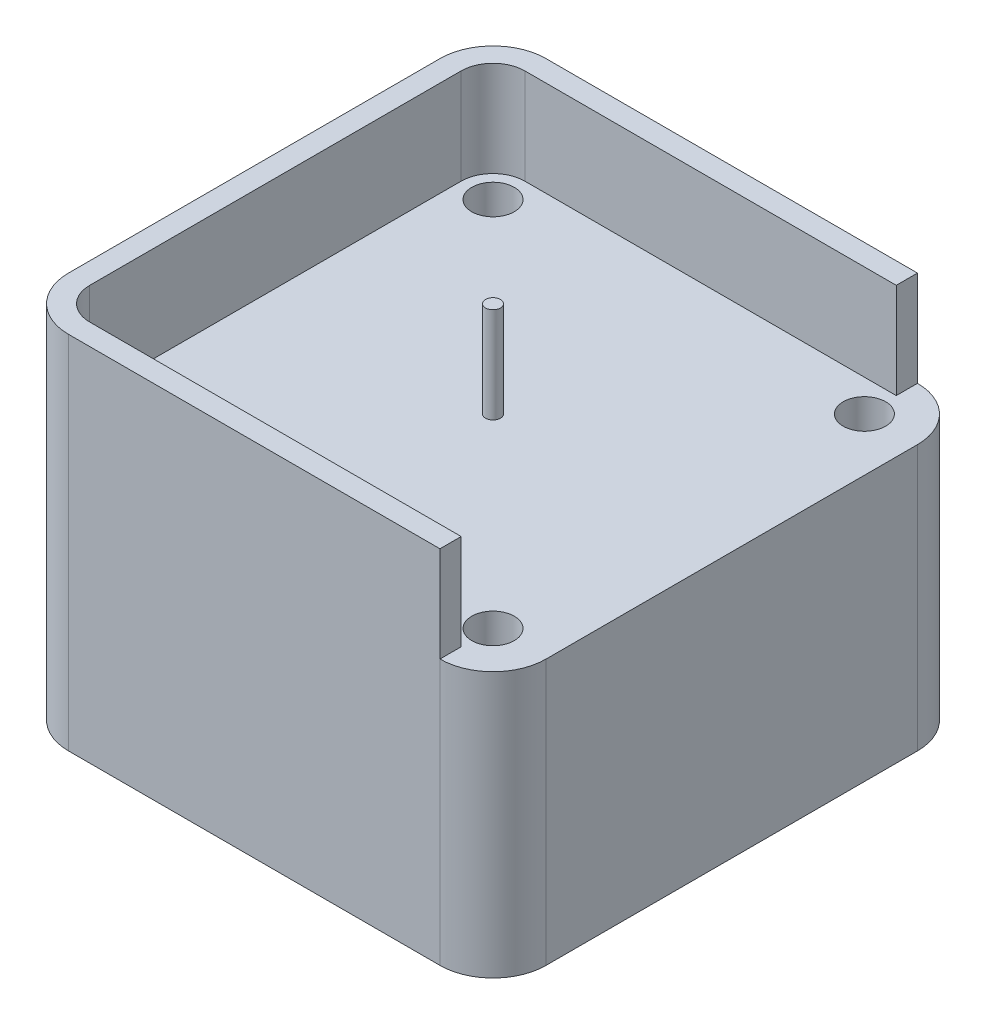
from build123d import *

# Parameters (mm, degrees)
SKETCH1_R           = 4
BOSS_EXTRUDE1_DEPTH = 50
EXTRUDE_THIN1_DEPTH = 18
SKETCH3_R           = 1.4
BOSS_EXTRUDE2_DEPTH = 18
SKETCH4_W           = 4.41201188
SKETCH4_H           = 70
CUT_EXTRUDE1_DEPTH  = 18
SKETCH5_W           = 12.080222771
SKETCH5_H           = 13.922777815
SKETCH5_W_2         = 14.701199749
SKETCH5_H_2         = 17.828925886
CUT_EXTRUDE2_DEPTH  = 18


with BuildPart() as part:
    # Sketch1 → Boss-Extrude1 (new body)
    with BuildSketch(Plane(origin=(0, 0, 0), x_dir=(1, 0, 0), z_dir=(0, 1, 0))):
        with BuildLine():
            Line((-53.889789303, 53.241491086), (16.110210697, 53.241491086))
            ThreePointArc((16.110210697, 53.241491086), (23.181278509, 50.312558898), (26.110210697, 43.241491086))
            Line((26.110210697, 43.241491086), (26.110210697, -26.758508914))
            ThreePointArc((26.110210697, -26.758508914), (23.181278509, -33.829576726), (16.110210697, -36.758508914))
            Line((16.110210697, -36.758508914), (-53.889789303, -36.758508914))
            ThreePointArc((-53.889789303, -36.758508914), (-60.960857115, -33.829576726), (-63.889789303, -26.758508914))
            Line((-63.889789303, -26.758508914), (-63.889789303, 43.241491086))
            ThreePointArc((-63.889789303, 43.241491086), (-60.960857115, 50.312558898), (-53.889789303, 53.241491086))
        make_face()
        with Locations(Location((-53.889789303, 43.241491086, 0), (0, 0, 270))):
            Circle(SKETCH1_R, mode=Mode.SUBTRACT)
        with Locations(Location((16.110210697, 43.241491086, 0), (0, 0, 270))):
            Circle(SKETCH1_R, mode=Mode.SUBTRACT)
        with Locations(Location((16.110210697, -26.758508914, 0), (0, 0, 270))):
            Circle(SKETCH1_R, mode=Mode.SUBTRACT)
        with Locations(Location((-53.889789303, -26.758508914, 0), (0, 0, 270))):
            Circle(SKETCH1_R, mode=Mode.SUBTRACT)
    extrude(amount=BOSS_EXTRUDE1_DEPTH)

    # Sketch2 → Extrude-Thin1 (add)
    with BuildSketch(Plane(origin=(0, 50, 0), x_dir=(1, 0, 0), z_dir=(0, 1, 0))):
        with BuildLine():
            Line((26.110210697, -26.758508914), (26.110210697, 43.241491086))
            ThreePointArc((26.110210697, 43.241491086), (23.181278509, 50.312558898), (16.110210697, 53.241491086))
            Line((16.110210697, 53.241491086), (-53.889789303, 53.241491086))
            ThreePointArc((-53.889789303, 53.241491086), (-60.960857115, 50.312558898), (-63.889789303, 43.241491086))
            Line((-63.889789303, 43.241491086), (-63.889789303, -26.758508914))
            ThreePointArc((-63.889789303, -26.758508914), (-60.960857115, -33.829576726), (-53.889789303, -36.758508914))
            Line((-53.889789303, -36.758508914), (16.110210697, -36.758508914))
            ThreePointArc((16.110210697, -36.758508914), (23.181278509, -33.829576726), (26.110210697, -26.758508914))
        make_face()
        with BuildLine():
            Line((22.110210697, -26.758508914), (22.110210697, 43.241491086))
            ThreePointArc((22.110210697, 43.241491086), (20.352851384, 47.484131773), (16.110210697, 49.241491086))
            Line((16.110210697, 49.241491086), (-53.889789303, 49.241491086))
            ThreePointArc((-53.889789303, 49.241491086), (-58.13242999, 47.484131773), (-59.889789303, 43.241491086))
            Line((-59.889789303, 43.241491086), (-59.889789303, -26.758508914))
            ThreePointArc((-59.889789303, -26.758508914), (-58.13242999, -31.001149601), (-53.889789303, -32.758508914))
            Line((-53.889789303, -32.758508914), (16.110210697, -32.758508914))
            ThreePointArc((16.110210697, -32.758508914), (20.352851384, -31.001149601), (22.110210697, -26.758508914))
        make_face(mode=Mode.SUBTRACT)
    extrude(amount=EXTRUDE_THIN1_DEPTH)

    # Sketch3 → Boss-Extrude2 (add)
    with BuildSketch(Plane(origin=(0, 50, 0), x_dir=(1, 0, 0), z_dir=(0, 1, 0))):
        with Locations(Location((-18.889789303, 8.241491086, 0), (0, 0, 90))):
            Circle(SKETCH3_R)
    extrude(amount=BOSS_EXTRUDE2_DEPTH)

    # Sketch4 → Cut-Extrude1 (cut)
    with BuildSketch(Plane(origin=(0, 68, 0), x_dir=(1, 0, 0), z_dir=(0, 1, 0))):
        with Locations((24.316216637, 8.241491086)):
            Rectangle(SKETCH4_W, SKETCH4_H)
    extrude(amount=-CUT_EXTRUDE1_DEPTH, mode=Mode.SUBTRACT)

    # Sketch5 → Cut-Extrude2 (cut)
    with BuildSketch(Plane(origin=(0, 68, 0), x_dir=(1, 0, 0), z_dir=(0, 1, 0))):
        with Locations((22.150322083, 46.280102179)):
            Rectangle(SKETCH5_W, SKETCH5_H)
        with Locations((23.460810572, -27.844045971)):
            Rectangle(SKETCH5_W_2, SKETCH5_H_2)
    extrude(amount=-CUT_EXTRUDE2_DEPTH, mode=Mode.SUBTRACT)


solid = part.part
